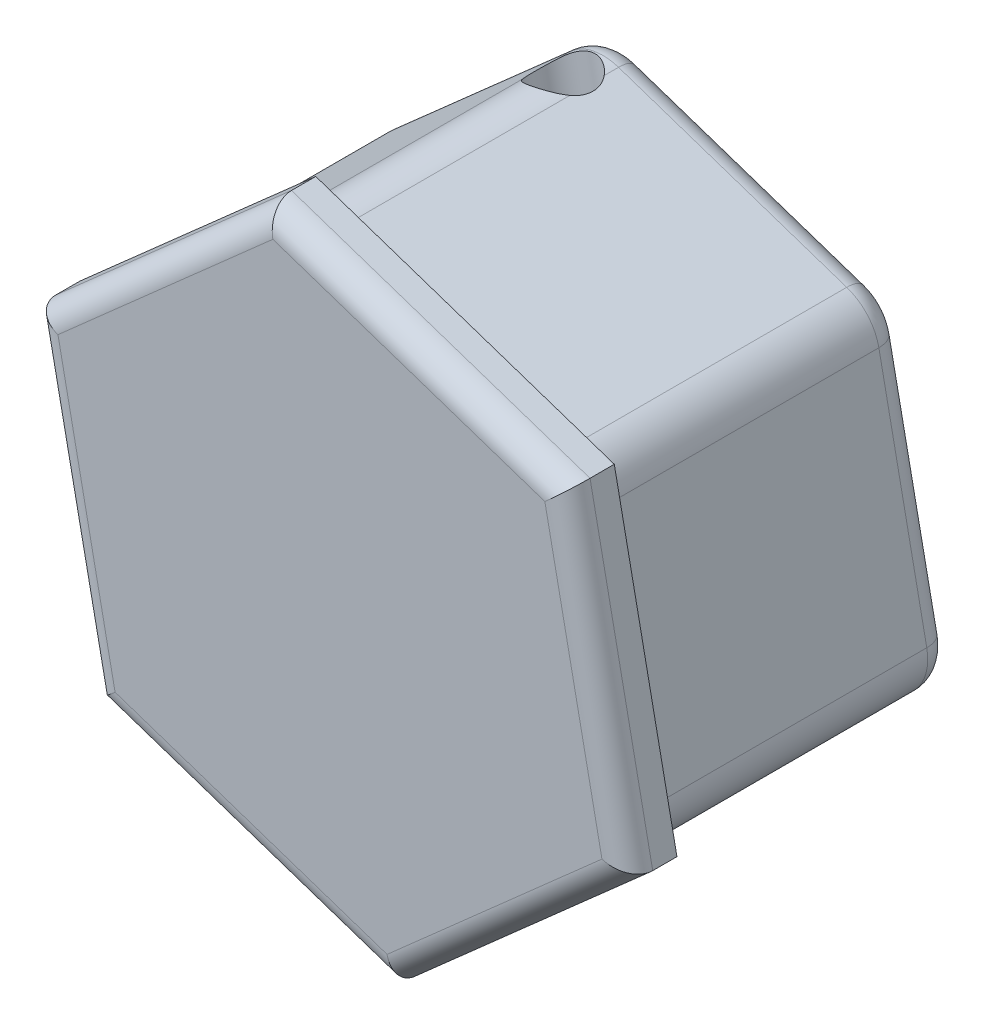
from build123d import *

# Parameters (mm, degrees)
DODANIE_WYCI_GNI_CIE1_DEPTH     = 14.25
ZAOKR_GLENIE1_R                 = 2
DODANIE_WYCI_GNI_CIE2_DEPTH     = 2
ZAOKR_GLENIE2_R                 = 1
ZAOKR_GLENIE3_R                 = 1
WYTNIJ_WYCI_GNI_CIE1_DEPTH      = 30.954621541
WYTNIJ_WYCI_GNI_CIE1_DEPTH_BACK = 30.954621541
SZKIC4_R                        = 1.225


with BuildPart() as part:
    # Szkic1 → Dodanie-wyciągnięcie1 (new body)
    with BuildSketch(Plane.XY):
        Polygon((1.783068787, -4.564092652), (-0.653727134, 7.430712848), (-12.25993137, 11.317788426), (-21.429339686, 3.210058505), (-18.992543765, -8.784746995), (-7.386339528, -12.671822573), align=None)
    extrude(amount=DODANIE_WYCI_GNI_CIE1_DEPTH)

    # Zaokrąglenie1
    zaokr_glenie1_edges = [part.edges().sort_by_distance(p)[0] for p in [
        (-7.386339528, -12.671822573, 7.125),
        (-18.992543765, -8.784746995, 7.125),
        (-21.429339686, 3.210058505, 7.125),
        (-12.25993137, 11.317788426, 7.125),
        (-0.653727134, 7.430712848, 7.125),
        (1.783068787, -4.564092652, 7.125),
    ]]
    fillet(zaokr_glenie1_edges, radius=ZAOKR_GLENIE1_R)

    # Szkic3 → Dodanie-wyciągnięcie2 (add)
    with BuildSketch(Plane.XY.offset(14.25)):
        Polygon((-0.091452095, 7.927884965), (-12.409357535, 12.053318952), (-22.141040889, 3.448416913), (-19.554818803, -9.281919113), (-7.236913363, -13.407353099), (2.494769991, -4.80245106), align=None)
    extrude(amount=-DODANIE_WYCI_GNI_CIE2_DEPTH)

    # Zaokrąglenie2
    zaokr_glenie2_edges = [part.edges().sort_by_distance(p)[0] for p in [
        (-6.456829252, 9.374250637, 0),
        (-2.80163537, -8.617957613, 0),
        (-13.189441647, -10.728284784, 0),
        (-20.210941725, -2.787344245, 0),
        (-16.844635528, 7.263923465, 0),
        (0.564670827, 1.433310098, 0),
        (-12.198333493, 11.014581025, 0),
        (-21.135955436, 3.111800131, 0),
        (-18.760757392, -8.579797968, 0),
        (-7.447937406, -12.368615173, 0),
        (1.489684537, -4.465834278, 0),
        (-0.885513507, 7.225763821, 0),
    ]]
    fillet(zaokr_glenie2_edges, radius=ZAOKR_GLENIE2_R)

    # Zaokrąglenie3
    zaokr_glenie3_edges = [part.edges().sort_by_distance(p)[0] for p in [
        (1.201658948, 1.562716953, 14.25),
        (-6.250404815, 9.990601959, 14.25),
        (-17.275199212, 7.750867932, 14.25),
        (-20.847929846, -2.9167511, 14.25),
        (-13.395866083, -11.344636106, 14.25),
        (-2.371071686, -9.10490208, 14.25),
    ]]
    fillet(zaokr_glenie3_edges, radius=ZAOKR_GLENIE3_R)

    # Szkic4 → Wytnij-wyciągnięcie1 (cut, two sides: drawn at the far end of the back side and taken through both)
    with BuildSketch(Plane(origin=(-0.257260592, 1.266331223, 0), x_dir=(0.9799817241599056, 0.19908746899937949, 0), z_dir=(-0.19908746899937946, 0.9799817241599055, 0)).offset(-WYTNIJ_WYCI_GNI_CIE1_DEPTH_BACK)):
        with Locations(Location((-9.76127883, -2.3, 0), (0, 0, 215.281261827))):
            Circle(SZKIC4_R)
    extrude(amount=WYTNIJ_WYCI_GNI_CIE1_DEPTH + WYTNIJ_WYCI_GNI_CIE1_DEPTH_BACK, mode=Mode.SUBTRACT)


solid = part.part
